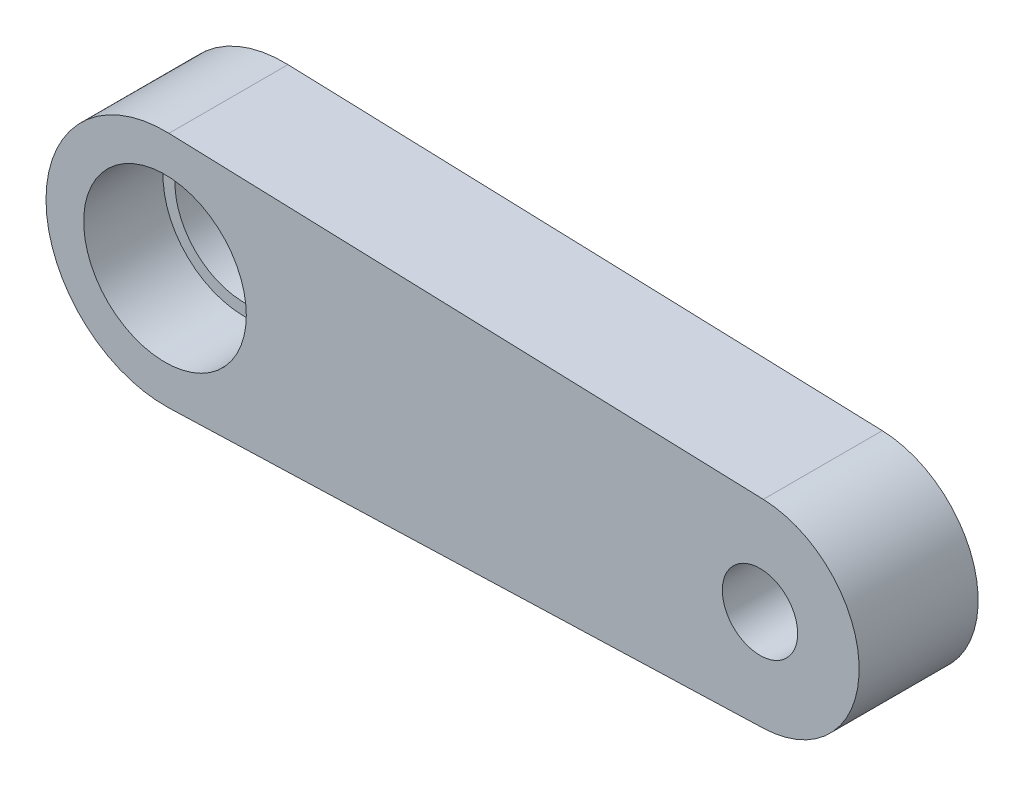
from build123d import *

# Parameters (mm, degrees)
EXTRUDE_1_DEPTH          = 6
SKETCH_3_R               = 4.1
CUT_EXTRUDE_2_DEPTH      = 1.2
SKETCH_4_R               = 4.1
CUT_EXTRUDE_3_DEPTH      = 4
SKETCH_5_R               = 3.5
CUT_EXTRUDE_5_DEPTH      = 37.986484018
CUT_EXTRUDE_6_DEPTH      = 37.986484018
CUT_EXTRUDE_6_DEPTH_BACK = 37.986484018
SKETCH_6_R               = 1.9


with BuildPart() as part:
    # ｽｹｯﾁ1 → ﾎﾞｽ - 押し出し1 (new body)
    with BuildSketch(Plane.XY):
        with BuildLine():
            Line((0.166666667, 4.99722145), (-29.8, 5.99666574))
            ThreePointArc((-29.8, 5.99666574), (-36, 0), (-29.8, -5.99666574))
            Line((-29.8, -5.99666574), (0.166666667, -4.99722145))
            ThreePointArc((0.166666667, -4.99722145), (5, 0), (0.166666667, 4.99722145))
        make_face()
    extrude(amount=EXTRUDE_1_DEPTH)

    # ｽｹｯﾁ3 → ｶｯﾄ - 押し出し2 (cut)
    with BuildSketch(Plane(origin=(0, 0, 0), x_dir=(-1, 0, 0), z_dir=(0, 0, -1))):
        Circle(SKETCH_3_R)
    extrude(amount=-CUT_EXTRUDE_2_DEPTH, mode=Mode.SUBTRACT)

    # ｽｹｯﾁ4 → ｶｯﾄ - 押し出し3 (cut)
    with BuildSketch(Plane.XY.offset(6)):
        with Locations((-30, 0)):
            Circle(SKETCH_4_R)
    extrude(amount=-CUT_EXTRUDE_3_DEPTH, mode=Mode.SUBTRACT)

    # ｽｹｯﾁ5 → ｶｯﾄ - 押し出し5 (cut, through all)
    with BuildSketch(Plane.XY.offset(6)):
        with Locations((-30, 0)):
            Circle(SKETCH_5_R)
    extrude(amount=-CUT_EXTRUDE_5_DEPTH, mode=Mode.SUBTRACT)

    # ｽｹｯﾁ6 → ｶｯﾄ - 押し出し6 (cut, two sides: drawn at the far end of the back side and taken through both)
    with BuildSketch(Plane.XY.offset(6).offset(-CUT_EXTRUDE_6_DEPTH_BACK)):
        with Locations(Location((0, 0, 0), (0, 0, 180))):
            Circle(SKETCH_6_R)
    extrude(amount=CUT_EXTRUDE_6_DEPTH + CUT_EXTRUDE_6_DEPTH_BACK, mode=Mode.SUBTRACT)


solid = part.part
